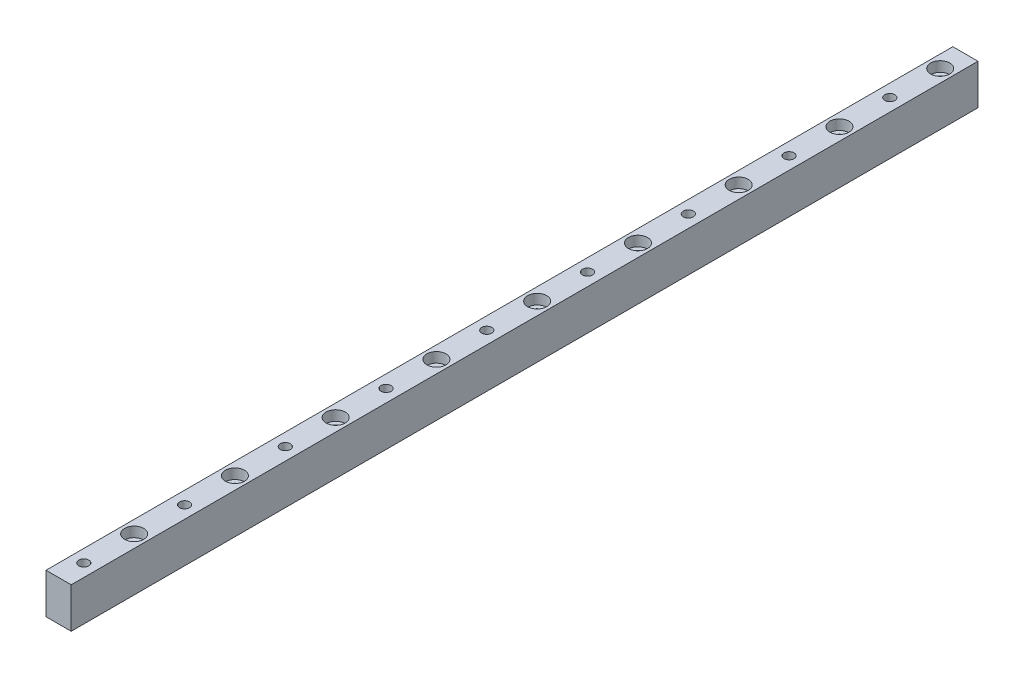
from build123d import *

# Parameters (mm, degrees)
SKETCH1_W                         = 5
SKETCH1_H                         = 8
BOSS_EXTRUDE1_DEPTH               = 185
SKETCH2_R                         = 1
CUT_EXTRUDE2_DEPTH                = 2
F_2_0_2_DIAMETER_HOLE1_AT_2_COUNT = 2
F_2_0_2_DIAMETER_HOLE1_AT_2_PITCH = 20
LPATTERN1_COUNT                   = 8
LPATTERN1_PITCH                   = 20
SKETCH6_R                         = 1
CUT_EXTRUDE3_DEPTH                = 186.189767536
SKETCH8_R                         = 1.9
CUT_EXTRUDE4_DEPTH                = 2
SKETCH9_W                         = 5
SKETCH9_H                         = 8
CUT_EXTRUDE5_DEPTH                = 5


with BuildPart() as part:
    # Sketch1 → Boss-Extrude1 (new body)
    with BuildSketch(Plane.XY):
        Rectangle(SKETCH1_W, SKETCH1_H)
    extrude(amount=BOSS_EXTRUDE1_DEPTH)

    # Sketch2 → Cut-Extrude2 (cut)
    with BuildSketch(Plane(origin=(0, 4, 0), x_dir=(1, 0, 0), z_dir=(0, 1, 0))):
        with Locations(Location((0, -20, 0), (0, 0, 270))):
            Circle(SKETCH2_R)
        with Locations(Location((0, -40, 0), (0, 0, 270))):
            Circle(SKETCH2_R)
        with Locations(Location((0, -60, 0), (0, 0, 270))):
            Circle(SKETCH2_R)
        with Locations(Location((0, -80, 0), (0, 0, 270))):
            Circle(SKETCH2_R)
        with Locations(Location((0, -100, 0), (0, 0, 270))):
            Circle(SKETCH2_R)
        with Locations(Location((0, -120, 0), (0, 0, 270))):
            Circle(SKETCH2_R)
        with Locations(Location((0, -140, 0), (0, 0, 270))):
            Circle(SKETCH2_R)
        with Locations(Location((0, -160, 0), (0, 0, 270))):
            Circle(SKETCH2_R)
        with Locations(Location((0, -180, 0), (0, 0, 270))):
            Circle(SKETCH2_R)
    extrude(amount=-CUT_EXTRUDE2_DEPTH, mode=Mode.SUBTRACT)

    # Sketch4 → Ø2.0 (2) Diameter Hole1 (revolve, cut)
    with BuildSketch(Plane(origin=(0, 4, 20), x_dir=(0, 0, 1), z_dir=(1, 0, 0))):
        Polygon((0, 0), (0, 2.600860619), (1, 2), (1, 0), align=None)
    f_2_0_2_diameter_hole1 = revolve(axis=Axis((0, 10.35, 20), (0, -1, 0)), mode=Mode.SUBTRACT)

    # Ø2.0 (2) Diameter Hole1 at 2: Ø2.0 (2) Diameter Hole1 ×2
    with Locations(*[(0, 0, i * F_2_0_2_DIAMETER_HOLE1_AT_2_PITCH) for i in range(1, F_2_0_2_DIAMETER_HOLE1_AT_2_COUNT)]):
        add(f_2_0_2_diameter_hole1, mode=Mode.SUBTRACT)

    # LPattern1: Ø2.0 (2) Diameter Hole1 ×8
    with Locations(*[(0, 0, i * LPATTERN1_PITCH) for i in range(1, LPATTERN1_COUNT)]):
        add(f_2_0_2_diameter_hole1, mode=Mode.SUBTRACT)

    # LPattern1 copy 1 sketch → LPattern1 copy 1 (revolve, cut)
    with BuildSketch(Plane(origin=(0, 4, 60), x_dir=(0, 0, 1), z_dir=(1, 0, 0))):
        Polygon((0, 0), (0, 2.600860619), (1, 2), (1, 0), align=None)
    revolve(axis=Axis((0, 10.35, 60), (0, -1, 0)), mode=Mode.SUBTRACT)

    # LPattern1 copy 2 sketch → LPattern1 copy 2 (revolve, cut)
    with BuildSketch(Plane(origin=(0, 4, 80), x_dir=(0, 0, 1), z_dir=(1, 0, 0))):
        Polygon((0, 0), (0, 2.600860619), (1, 2), (1, 0), align=None)
    revolve(axis=Axis((0, 10.35, 80), (0, -1, 0)), mode=Mode.SUBTRACT)

    # LPattern1 copy 3 sketch → LPattern1 copy 3 (revolve, cut)
    with BuildSketch(Plane(origin=(0, 4, 100), x_dir=(0, 0, 1), z_dir=(1, 0, 0))):
        Polygon((0, 0), (0, 2.600860619), (1, 2), (1, 0), align=None)
    revolve(axis=Axis((0, 10.35, 100), (0, -1, 0)), mode=Mode.SUBTRACT)

    # LPattern1 copy 4 sketch → LPattern1 copy 4 (revolve, cut)
    with BuildSketch(Plane(origin=(0, 4, 120), x_dir=(0, 0, 1), z_dir=(1, 0, 0))):
        Polygon((0, 0), (0, 2.600860619), (1, 2), (1, 0), align=None)
    revolve(axis=Axis((0, 10.35, 120), (0, -1, 0)), mode=Mode.SUBTRACT)

    # LPattern1 copy 5 sketch → LPattern1 copy 5 (revolve, cut)
    with BuildSketch(Plane(origin=(0, 4, 140), x_dir=(0, 0, 1), z_dir=(1, 0, 0))):
        Polygon((0, 0), (0, 2.600860619), (1, 2), (1, 0), align=None)
    revolve(axis=Axis((0, 10.35, 140), (0, -1, 0)), mode=Mode.SUBTRACT)

    # LPattern1 copy 6 sketch → LPattern1 copy 6 (revolve, cut)
    with BuildSketch(Plane(origin=(0, 4, 160), x_dir=(0, 0, 1), z_dir=(1, 0, 0))):
        Polygon((0, 0), (0, 2.600860619), (1, 2), (1, 0), align=None)
    revolve(axis=Axis((0, 10.35, 160), (0, -1, 0)), mode=Mode.SUBTRACT)

    # LPattern1 copy 7 sketch → LPattern1 copy 7 (revolve, cut)
    with BuildSketch(Plane(origin=(0, 4, 180), x_dir=(0, 0, 1), z_dir=(1, 0, 0))):
        Polygon((0, 0), (0, 2.600860619), (1, 2), (1, 0), align=None)
    revolve(axis=Axis((0, 10.35, 180), (0, -1, 0)), mode=Mode.SUBTRACT)

    # Sketch6 → Cut-Extrude3 (cut, through all)
    with BuildSketch(Plane(origin=(0, 4, 0), x_dir=(1, 0, 0), z_dir=(0, 1, 0))):
        with Locations(Location((0, -30, 0), (0, 0, 270))):
            Circle(SKETCH6_R)
        with Locations(Location((0, -50, 0), (0, 0, 270))):
            Circle(SKETCH6_R)
        with Locations(Location((0, -70, 0), (0, 0, 270))):
            Circle(SKETCH6_R)
        with Locations(Location((0, -90, 0), (0, 0, 270))):
            Circle(SKETCH6_R)
        with Locations(Location((0, -110, 0), (0, 0, 270))):
            Circle(SKETCH6_R)
        with Locations(Location((0, -130, 0), (0, 0, 270))):
            Circle(SKETCH6_R)
        with Locations(Location((0, -150, 0), (0, 0, 270))):
            Circle(SKETCH6_R)
        with Locations(Location((0, -170, 0), (0, 0, 270))):
            Circle(SKETCH6_R)
        with Locations((0, -190)):
            Circle(SKETCH6_R)
        with Locations(Location((0, -10, 0), (0, 0, 270))):
            Circle(SKETCH6_R)
    extrude(amount=-CUT_EXTRUDE3_DEPTH, mode=Mode.SUBTRACT)

    # Sketch8 → Cut-Extrude4 (cut)
    with BuildSketch(Plane(origin=(0, 4, 0), x_dir=(1, 0, 0), z_dir=(0, 1, 0))):
        with Locations(Location((0, -10, 0), (0, 0, 270))):
            Circle(SKETCH8_R)
        with Locations(Location((0, -30, 0), (0, 0, 270))):
            Circle(SKETCH8_R)
        with Locations(Location((0, -50, 0), (0, 0, 270))):
            Circle(SKETCH8_R)
        with Locations(Location((0, -70, 0), (0, 0, 270))):
            Circle(SKETCH8_R)
        with Locations(Location((0, -90, 0), (0, 0, 270))):
            Circle(SKETCH8_R)
        with Locations(Location((0, -110, 0), (0, 0, 270))):
            Circle(SKETCH8_R)
        with Locations(Location((0, -130, 0), (0, 0, 270))):
            Circle(SKETCH8_R)
        with Locations(Location((0, -150, 0), (0, 0, 270))):
            Circle(SKETCH8_R)
        with Locations(Location((0, -170, 0), (0, 0, 270))):
            Circle(SKETCH8_R)
        with Locations((0, -190)):
            Circle(SKETCH8_R)
    extrude(amount=-CUT_EXTRUDE4_DEPTH, mode=Mode.SUBTRACT)

    # Sketch9 → Cut-Extrude5 (cut)
    with BuildSketch(Plane(origin=(0, 0, 0), x_dir=(-1, 0, 0), z_dir=(0, 0, -1))):
        Rectangle(SKETCH9_W, SKETCH9_H)
    extrude(amount=-CUT_EXTRUDE5_DEPTH, mode=Mode.SUBTRACT)


solid = part.part
